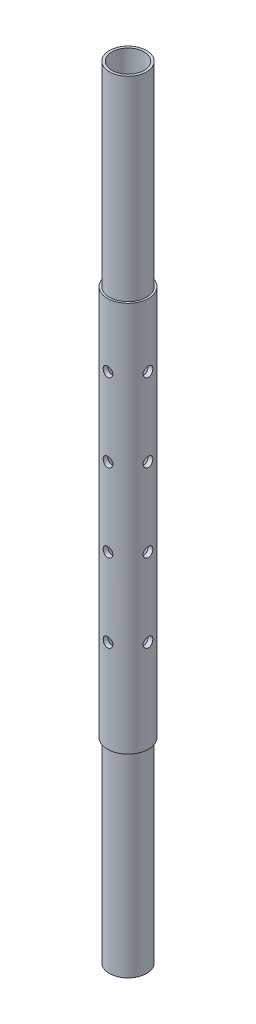
from build123d import *

# Parameters (mm, degrees)
SKETCH1_R           = 13.335
SKETCH1_R_2         = 10.4648
BOSS_EXTRUDE1_DEPTH = 254
SKETCH2_R           = 3.175
CUT_EXTRUDE1_DEPTH  = 63.5
SKETCH3_R           = 3.175
CUT_EXTRUDE2_DEPTH  = 63.5
SKETCH4_R           = 13.335
SKETCH4_R_2         = 12.065
CUT_EXTRUDE3_DEPTH  = 127
CUT_EXTRUDE4_START  = -127
SKETCH5_R           = 13.335
SKETCH5_R_2         = 12.065
CUT_EXTRUDE4_DEPTH  = 127


with BuildPart() as part:
    # Sketch1 → Boss-Extrude1 (new, symmetric)
    with BuildSketch(Plane(origin=(0, 0, 0), x_dir=(1, 0, 0), z_dir=(0, 1, 0))):
        with Locations(Location((0, 0, 0), (0, 0, 270))):
            Circle(SKETCH1_R)
        with Locations(Location((0, 0, 0), (0, 0, 270))):
            Circle(SKETCH1_R_2, mode=Mode.SUBTRACT)
    extrude(amount=BOSS_EXTRUDE1_DEPTH, both=True)

    # Sketch2 → Cut-Extrude1 (cut, symmetric)
    with BuildSketch(Plane.XY):
        with Locations((0, -66.675)):
            Circle(SKETCH2_R)
        with Locations((0, -15.875)):
            Circle(SKETCH2_R)
        with Locations((0, 34.925)):
            Circle(SKETCH2_R)
        with Locations((0, 85.725)):
            Circle(SKETCH2_R)
    extrude(amount=CUT_EXTRUDE1_DEPTH, both=True, mode=Mode.SUBTRACT)

    # Sketch3 → Cut-Extrude2 (cut, symmetric)
    with BuildSketch(Plane(origin=(0, 0, 0), x_dir=(0, 0, -1), z_dir=(1, 0, 0))):
        with Locations((0, -66.675)):
            Circle(SKETCH3_R)
        with Locations((0, -15.875)):
            Circle(SKETCH3_R)
        with Locations((0, 34.925)):
            Circle(SKETCH3_R)
        with Locations((0, 85.725)):
            Circle(SKETCH3_R)
    extrude(amount=CUT_EXTRUDE2_DEPTH, both=True, mode=Mode.SUBTRACT)

    # Sketch4 → Cut-Extrude3 (cut)
    with BuildSketch(Plane(origin=(0, 254, 0), x_dir=(1, 0, 0), z_dir=(0, 1, 0))):
        with Locations(Location((0, 0, 0), (0, 0, 270))):
            Circle(SKETCH4_R)
        with Locations(Location((0, 0, 0), (0, 0, 270))):
            Circle(SKETCH4_R_2, mode=Mode.SUBTRACT)
    extrude(amount=-CUT_EXTRUDE3_DEPTH, mode=Mode.SUBTRACT)

    # Sketch5 → Cut-Extrude4 (cut)
    with BuildSketch(Plane.XZ.offset(254).offset(CUT_EXTRUDE4_START)):
        with Locations(Location((0, 0, 0), (0, 0, 270))):
            Circle(SKETCH5_R)
        with Locations(Location((0, 0, 0), (0, 0, 90))):
            Circle(SKETCH5_R_2, mode=Mode.SUBTRACT)
    extrude(amount=CUT_EXTRUDE4_DEPTH, mode=Mode.SUBTRACT)


solid = part.part
